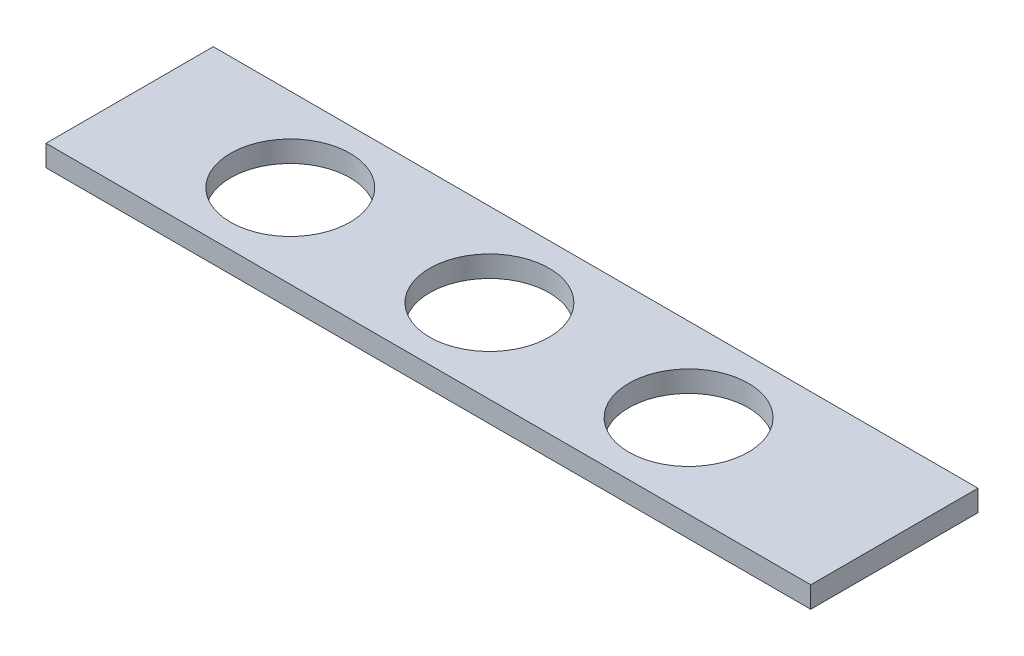
from build123d import *

# Parameters (mm, degrees)
SKETCH_1_W          = 288
SKETCH_1_H          = 63
EXTRUDE_1_DEPTH     = 8
SKETCH_2_R          = 22.5
CUT_EXTRUDE_1_DEPTH = 8
SKETCH_2_3_R        = 22.5
CUT_EXTRUDE_2_DEPTH = 8
SKETCH_2_4_R        = 22.5
CUT_EXTRUDE_3_DEPTH = 8


with BuildPart() as part:
    # Эскиз1 → Бобышка-Вытянуть1 (new body)
    with BuildSketch(Plane(origin=(0, 0, 0), x_dir=(1, 0, 0), z_dir=(0, 1, 0))):
        with Locations((144, 31.5)):
            Rectangle(SKETCH_1_W, SKETCH_1_H)
    extrude(amount=EXTRUDE_1_DEPTH)

    # Эскиз2 → Вырез-Вытянуть1 (cut)
    with BuildSketch(Plane(origin=(0, 8, 0), x_dir=(1, 0, 0), z_dir=(0, 1, 0))):
        with Locations((60.5, 31.5)):
            Circle(SKETCH_2_R)
    extrude(amount=-CUT_EXTRUDE_1_DEPTH, mode=Mode.SUBTRACT)

    # Эскиз2<3> → Вырез-Вытянуть2 (cut)
    with BuildSketch(Plane(origin=(0, 8, 0), x_dir=(1, 0, 0), z_dir=(0, 1, 0))):
        with Locations((135.5, 31.5)):
            Circle(SKETCH_2_3_R)
    extrude(amount=-CUT_EXTRUDE_2_DEPTH, mode=Mode.SUBTRACT)

    # Эскиз2<4> → Вырез-Вытянуть3 (cut)
    with BuildSketch(Plane(origin=(0, 8, 0), x_dir=(1, 0, 0), z_dir=(0, 1, 0))):
        with Locations((210.5, 31.5)):
            Circle(SKETCH_2_4_R)
    extrude(amount=-CUT_EXTRUDE_3_DEPTH, mode=Mode.SUBTRACT)


solid = part.part
